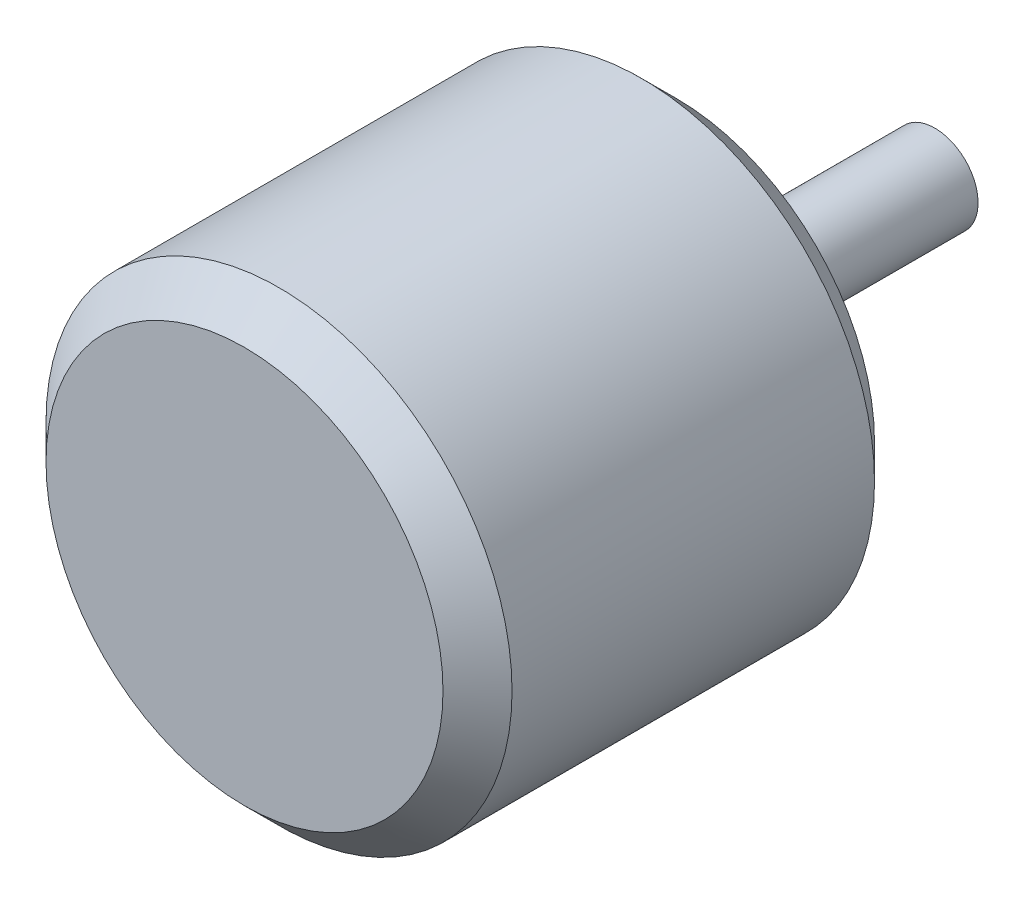
from build123d import *

# Parameters (mm, degrees)
SKETCH_1_R      = 13.5
EXTRUDE_1_DEPTH = 25
CHAMFER_1_SIZE  = 2
SKETCH_2_R      = 2.5
EXTRUDE_2_DEPTH = 15


with BuildPart() as part:
    # 스케치1 → 보스-돌출1 (new body)
    with BuildSketch(Plane.XY):
        Circle(SKETCH_1_R)
    extrude(amount=EXTRUDE_1_DEPTH)

    # 모따기1
    chamfer_1_edges = [part.edges().sort_by_distance(p)[0] for p in [
        (-13.5, 0, 0),
        (-13.5, 0, 25),
    ]]
    chamfer(chamfer_1_edges, length=CHAMFER_1_SIZE)

    # 스케치2 → 보스-돌출2 (add)
    with BuildSketch(Plane(origin=(0, 0, 0), x_dir=(-1, 0, 0), z_dir=(0, 0, -1))):
        Circle(SKETCH_2_R)
    extrude(amount=EXTRUDE_2_DEPTH)


solid = part.part
